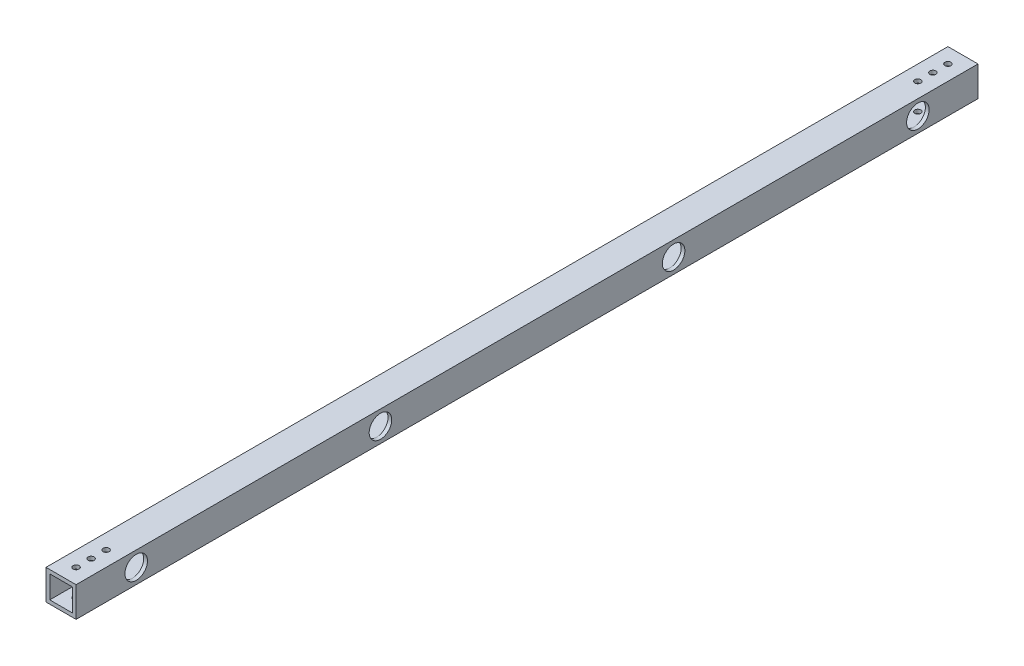
from build123d import *

# Parameters (mm, degrees)
SKETCH1_W              = 25.4
SKETCH1_H              = 25.4
SKETCH1_W_2            = 19.05
SKETCH1_H_2            = 19.05
BOSS_EXTRUDE1_DEPTH    = 762
F_10_CLEARANCE_HOLE1_D = 5.1054
CUT_EXTRUDE1_REACH     = 764.846
SKETCH5_R              = 9.525


with BuildPart() as part:
    # Sketch1 → Boss-Extrude1 (new body)
    with BuildSketch(Plane.XY):
        with Locations((-12.7, 12.7)):
            Rectangle(SKETCH1_W, SKETCH1_H)
        with Locations((-12.7, 12.7)):
            Rectangle(SKETCH1_W_2, SKETCH1_H_2, mode=Mode.SUBTRACT)
    extrude(amount=BOSS_EXTRUDE1_DEPTH)

    # #10 Clearance Hole1 (through all)
    with Locations(Plane(origin=(0, 25.4, 0), x_dir=(1, 0, 0), z_dir=(0, 1, 0))):
        with Locations((-12.7, -749.3), (-12.7, -736.6), (-12.7, -723.9), (-12.7, -38.1), (-12.7, -25.4), (-12.7, -12.7)):
            Hole(F_10_CLEARANCE_HOLE1_D / 2)

    # Cut-Extrude1: up to this face of the body (flat: up to its plane)
    cut_extrude1_end = Plane(part.part.faces().sort_by_distance((0, 12.7, 381))[0])
    # Sketch5 → Cut-Extrude1 (cut, up to the picked face)
    with BuildSketch(Plane.ZY.offset(25.4), mode=Mode.PRIVATE) as cut_extrude1_sk1:
        with Locations(Location((50.8, 12.7, 0), (0, 0, 270))):
            Circle(SKETCH5_R)
    cut_extrude1_tool1 = split(extrude(cut_extrude1_sk1.sketch, amount=-CUT_EXTRUDE1_REACH, mode=Mode.PRIVATE), bisect_by=cut_extrude1_end, keep=Keep.BOTH, mode=Mode.PRIVATE)
    # Sketch5 → Cut-Extrude1 (cut, up to the picked face)
    with BuildSketch(Plane.ZY.offset(25.4), mode=Mode.PRIVATE) as cut_extrude1_sk2:
        with Locations(Location((711.2, 12.7, 0), (0, 0, 270))):
            Circle(SKETCH5_R)
    cut_extrude1_tool2 = split(extrude(cut_extrude1_sk2.sketch, amount=-CUT_EXTRUDE1_REACH, mode=Mode.PRIVATE), bisect_by=cut_extrude1_end, keep=Keep.BOTH, mode=Mode.PRIVATE)
    # Sketch5 → Cut-Extrude1 (cut, up to the picked face)
    with BuildSketch(Plane.ZY.offset(25.4), mode=Mode.PRIVATE) as cut_extrude1_sk3:
        with Locations(Location((504.825, 12.7, 0), (0, 0, 270))):
            Circle(SKETCH5_R)
    cut_extrude1_tool3 = split(extrude(cut_extrude1_sk3.sketch, amount=-CUT_EXTRUDE1_REACH, mode=Mode.PRIVATE), bisect_by=cut_extrude1_end, keep=Keep.BOTH, mode=Mode.PRIVATE)
    # Sketch5 → Cut-Extrude1 (cut, up to the picked face)
    with BuildSketch(Plane.ZY.offset(25.4), mode=Mode.PRIVATE) as cut_extrude1_sk4:
        with Locations(Location((257.175, 12.7, 0), (0, 0, 270))):
            Circle(SKETCH5_R)
    cut_extrude1_tool4 = split(extrude(cut_extrude1_sk4.sketch, amount=-CUT_EXTRUDE1_REACH, mode=Mode.PRIVATE), bisect_by=cut_extrude1_end, keep=Keep.BOTH, mode=Mode.PRIVATE)
    add(cut_extrude1_tool1.solids().sort_by(Axis((-25.4, 12.7, 50.8), (1, 0, 0)))[0], mode=Mode.SUBTRACT)
    add(cut_extrude1_tool2.solids().sort_by(Axis((-25.4, 12.7, 711.2), (1, 0, 0)))[0], mode=Mode.SUBTRACT)
    add(cut_extrude1_tool3.solids().sort_by(Axis((-25.4, 12.7, 504.825), (1, 0, 0)))[0], mode=Mode.SUBTRACT)
    add(cut_extrude1_tool4.solids().sort_by(Axis((-25.4, 12.7, 257.175), (1, 0, 0)))[0], mode=Mode.SUBTRACT)


solid = part.part
